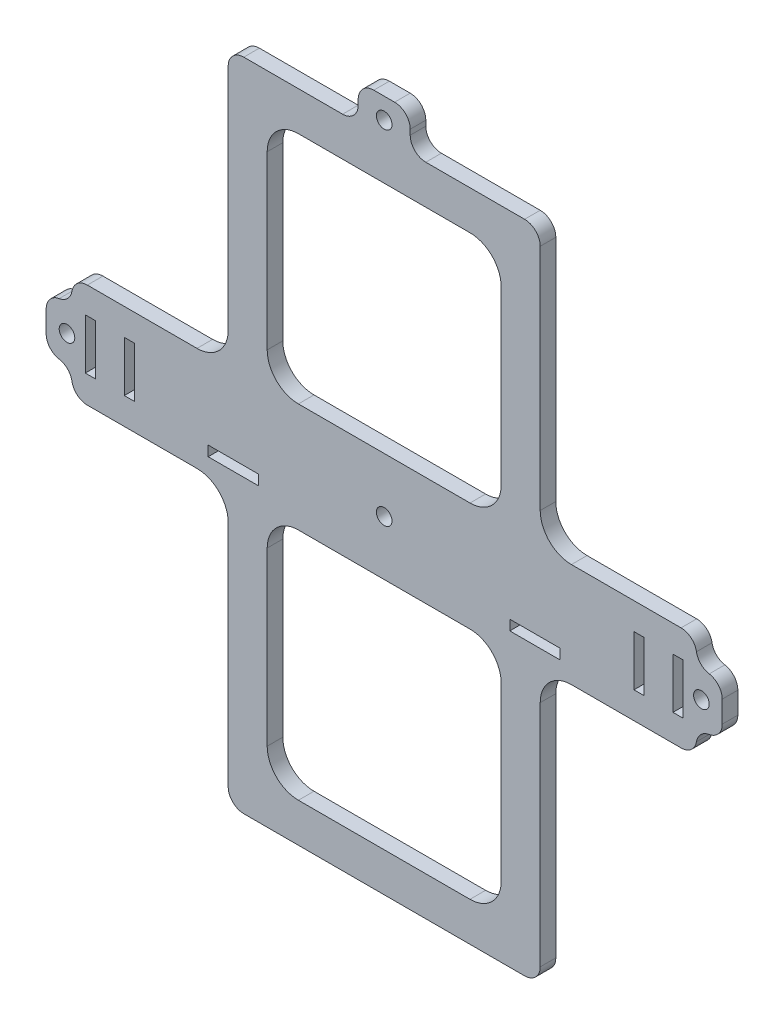
from build123d import *

# Parameters (mm, degrees)
MODEL_R         = 1.5
MODEL_W         = 9.700000003
MODEL_H         = 1.95
MODEL_W_2       = 1.95
MODEL_H_2       = 9.700000003
MODEL_H_3       = 9.7
EXTRUDE_1_DEPTH = 3


with BuildPart() as part:
    # Model → Бобышка-Вытянуть1 (new body)
    with BuildSketch(Plane.XY):
        with BuildLine():
            Line((36, -10), (57.083920217, -10))
            ThreePointArc((57.083920217, -10), (59.02041189, -9.291287847), (60.041960108, -7.5))
            ThreePointArc((60.041960108, -7.5), (60.878679656, -5.878679656), (62.5, -5.041960108))
            ThreePointArc((62.5, -5.041960108), (64.291287847, -4.02041189), (65, -2.083920217))
            Line((65, -2.083920217), (65, 2.083920217))
            ThreePointArc((65, 2.083920217), (64.291287847, 4.02041189), (62.5, 5.041960108))
            ThreePointArc((62.5, 5.041960108), (60.878679656, 5.878679656), (60.041960108, 7.5))
            ThreePointArc((60.041960108, 7.5), (59.02041189, 9.291287847), (57.083920217, 10))
            Line((57.083920217, 10), (36, 10))
            ThreePointArc((36, 10), (31.757359313, 11.757359313), (30, 16))
            Line((30, 16), (30, 60))
            ThreePointArc((30, 60), (29.121320344, 62.121320344), (27, 63))
            Line((27, 63), (8, 63))
            ThreePointArc((8, 63), (5.878679656, 63.878679656), (5, 66))
            Line((5, 66), (5, 67))
            ThreePointArc((5, 67), (4.121320344, 69.121320344), (2, 70))
            Line((2, 70), (-2, 70))
            ThreePointArc((-2, 70), (-4.121320344, 69.121320344), (-5, 67))
            Line((-5, 67), (-5, 66))
            ThreePointArc((-5, 66), (-5.878679656, 63.878679656), (-8, 63))
            Line((-8, 63), (-27, 63))
            ThreePointArc((-27, 63), (-29.121320344, 62.121320344), (-30, 60))
            Line((-30, 60), (-30, 16))
            ThreePointArc((-30, 16), (-31.757359313, 11.757359313), (-36, 10))
            Line((-36, 10), (-57.083920217, 10))
            ThreePointArc((-57.083920217, 10), (-59.02041189, 9.291287847), (-60.041960108, 7.5))
            ThreePointArc((-60.041960108, 7.5), (-60.878679656, 5.878679656), (-62.5, 5.041960108))
            ThreePointArc((-62.5, 5.041960108), (-64.291287847, 4.02041189), (-65, 2.083920217))
            Line((-65, 2.083920217), (-65, -2.083920217))
            ThreePointArc((-65, -2.083920217), (-64.291287847, -4.02041189), (-62.5, -5.041960108))
            ThreePointArc((-62.5, -5.041960108), (-60.878679656, -5.878679656), (-60.041960108, -7.5))
            ThreePointArc((-60.041960108, -7.5), (-59.02041189, -9.291287847), (-57.083920217, -10))
            Line((-57.083920217, -10), (-36, -10))
            ThreePointArc((-36, -10), (-31.757359313, -11.757359313), (-30, -16))
            Line((-30, -16), (-30, -60))
            ThreePointArc((-30, -60), (-29.121320344, -62.121320344), (-27, -63))
            Line((-27, -63), (8, -63))
            Line((8, -63), (27, -63))
            ThreePointArc((27, -63), (29.121320344, -62.121320344), (30, -60))
            Line((30, -60), (30, -16))
            ThreePointArc((30, -16), (31.757359313, -11.757359313), (36, -10))
        make_face()
        Circle(MODEL_R, mode=Mode.SUBTRACT)
        with Locations((0, 66)):
            Circle(MODEL_R, mode=Mode.SUBTRACT)
        with Locations((61, 0)):
            Circle(MODEL_R, mode=Mode.SUBTRACT)
        with Locations((-61, 0)):
            Circle(MODEL_R, mode=Mode.SUBTRACT)
        with Locations((-29.000000002, -6)):
            Rectangle(MODEL_W, MODEL_H, mode=Mode.SUBTRACT)
        with Locations((28.999999999, -6)):
            Rectangle(MODEL_W, MODEL_H, mode=Mode.SUBTRACT)
        with Locations((49, -1e-09)):
            Rectangle(MODEL_W_2, MODEL_H_2, mode=Mode.SUBTRACT)
        with Locations((-49, 0)):
            Rectangle(MODEL_W_2, MODEL_H_3, mode=Mode.SUBTRACT)
        with Locations((-56.5, 0)):
            Rectangle(MODEL_W_2, MODEL_H_3, mode=Mode.SUBTRACT)
        with Locations((56.5, 0)):
            Rectangle(MODEL_W_2, MODEL_H_3, mode=Mode.SUBTRACT)
        with BuildLine():
            Line((-16.5, 10.5), (16.5, 10.5))
            ThreePointArc((16.5, 10.5), (20.742640687, 12.257359313), (22.5, 16.5))
            Line((22.5, 16.5), (22.5, 49.5))
            ThreePointArc((22.5, 49.5), (20.742640687, 53.742640687), (16.5, 55.5))
            Line((16.5, 55.5), (-16.5, 55.5))
            ThreePointArc((-16.5, 55.5), (-20.742640687, 53.742640687), (-22.5, 49.5))
            Line((-22.5, 49.5), (-22.5, 16.5))
            ThreePointArc((-22.5, 16.5), (-20.742640687, 12.257359313), (-16.5, 10.5))
        make_face(mode=Mode.SUBTRACT)
        with BuildLine():
            Line((-16.5, -10.5), (16.5, -10.5))
            ThreePointArc((16.5, -10.5), (20.742640687, -12.257359313), (22.5, -16.5))
            Line((22.5, -16.5), (22.5, -49.5))
            ThreePointArc((22.5, -49.5), (20.742640687, -53.742640687), (16.5, -55.5))
            Line((16.5, -55.5), (-16.5, -55.5))
            ThreePointArc((-16.5, -55.5), (-20.742640687, -53.742640687), (-22.5, -49.5))
            Line((-22.5, -49.5), (-22.5, -16.5))
            ThreePointArc((-22.5, -16.5), (-20.742640687, -12.257359313), (-16.5, -10.5))
        make_face(mode=Mode.SUBTRACT)
    extrude(amount=EXTRUDE_1_DEPTH)


solid = part.part
